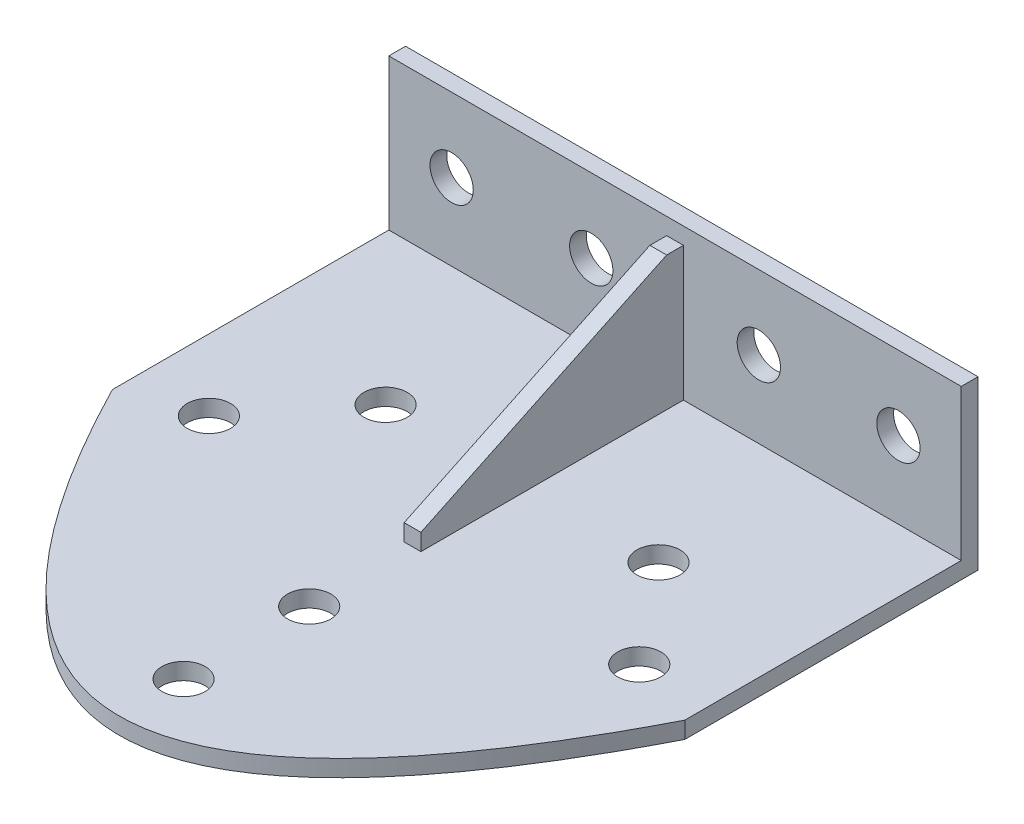
from build123d import *

# Parameters (mm, degrees)
SKETCH1_W      = 410
SKETCH1_H      = 120
SKETCH1_R      = 15.5
EXTRUDE1_DEPTH = 12
SKETCH2_W      = 410
SKETCH2_H      = 12
EXTRUDE2_DEPTH = 398
SKETCH3_R      = 15.5
EXTRUDE3_DEPTH = 198
SKETCH4_W      = 12
SKETCH4_H      = 96
EXTRUDE4_DEPTH = 188
EXTRUDE5_DEPTH = 188


with BuildPart() as part:
    # Sketch1 → Extrude1 (new body)
    with BuildSketch(Plane.XY):
        with Locations((205, 60)):
            Rectangle(SKETCH1_W, SKETCH1_H)
        with Locations((45, 67)):
            Circle(SKETCH1_R, mode=Mode.SUBTRACT)
        with Locations((145, 67)):
            Circle(SKETCH1_R, mode=Mode.SUBTRACT)
        with Locations((365, 67)):
            Circle(SKETCH1_R, mode=Mode.SUBTRACT)
        with Locations((265, 67)):
            Circle(SKETCH1_R, mode=Mode.SUBTRACT)
    extrude(amount=EXTRUDE1_DEPTH)

    # Sketch2 → Extrude2 (add)
    with BuildSketch(Plane.XY.offset(12)):
        with Locations((205, 6)):
            Rectangle(SKETCH2_W, SKETCH2_H)
    extrude(amount=EXTRUDE2_DEPTH)

    # Sketch3 → Extrude3 (cut)
    with BuildSketch(Plane(origin=(0, 12, 0), x_dir=(1, 0, 0), z_dir=(0, 1, 0))):
        with BuildLine():
            add(Edge.make_bspline(
                [(205, -410), (307.5, -410), (410, -210)],
                knots=[0.5, 0.5, 0.5, 1, 1, 1], degree=2))
            Line((205, -410), (410, -410))
            Line((410, -410), (410, -210))
        make_face()
        with BuildLine():
            add(Edge.make_bspline(
                [(0, -210), (102.5, -410), (205, -410)],
                knots=[0, 0, 0, 0.5, 0.5, 0.5], degree=2))
            Line((0, -210), (0, -410))
            Line((0, -410), (205, -410))
        make_face()
        with Locations(Location((107.261778202, -121.586347917, 0), (0, 0, 270))):
            Circle(SKETCH3_R)
        with Locations(Location((205, -364, 0), (0, 0, 270))):
            Circle(SKETCH3_R)
        with Locations(Location((50.874342549, -191.732317869, 0), (0, 0, 270))):
            Circle(SKETCH3_R)
        with Locations(Location((205, -274, 0), (0, 0, 270))):
            Circle(SKETCH3_R)
        with Locations(Location((359.125657451, -191.732317869, 0), (0, 0, 270))):
            Circle(SKETCH3_R)
        with Locations(Location((302.738221798, -121.586347917, 0), (0, 0, 270))):
            Circle(SKETCH3_R)
    extrude(amount=-EXTRUDE3_DEPTH, mode=Mode.SUBTRACT)

    # Sketch4 → Extrude4 (add)
    with BuildSketch(Plane.XY.offset(12)):
        with Locations((205, 60)):
            Rectangle(SKETCH4_W, SKETCH4_H)
    extrude(amount=EXTRUDE4_DEPTH)

    # Sketch5 → Extrude5 (cut)
    with BuildSketch(Plane.ZY.offset(-199)):
        Polygon((200, 108), (200, 24), (24, 108), align=None)
    extrude(amount=-EXTRUDE5_DEPTH, mode=Mode.SUBTRACT)


solid = part.part
